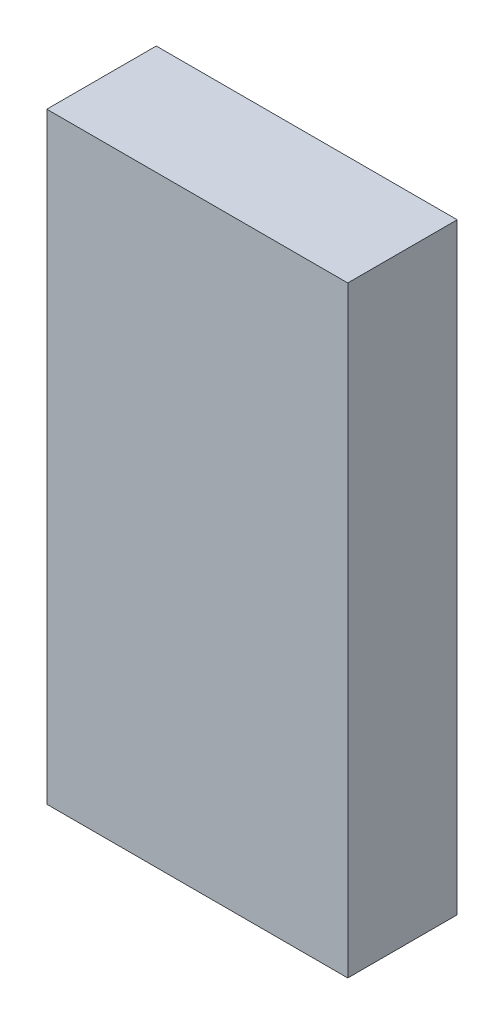
from build123d import *

# Parameters (mm, degrees)
SKETCH_1_W      = 110
SKETCH_1_H      = 220
EXTRUDE_1_DEPTH = 40


with BuildPart() as part:
    # ｽｹｯﾁ1 → ﾎﾞｽ - 押し出し1 (new body)
    with BuildSketch(Plane.XY):
        with Locations((55, 110)):
            Rectangle(SKETCH_1_W, SKETCH_1_H)
    extrude(amount=EXTRUDE_1_DEPTH)


solid = part.part
